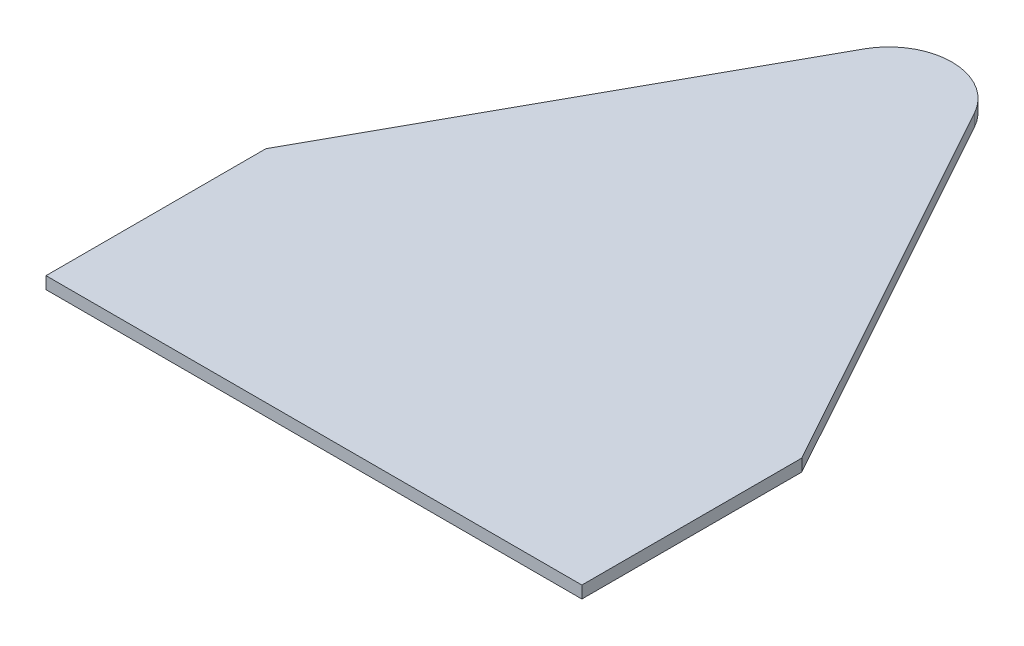
from build123d import *

# Parameters (mm, degrees)
BOSS_EXTRUDE1_DEPTH = 2.5


with BuildPart() as part:
    # Sketch1 → Boss-Extrude1 (new body)
    with BuildSketch(Plane(origin=(0, 0, 0), x_dir=(1, 0, 0), z_dir=(0, 1, 0))):
        with BuildLine():
            Line((-11.385, 124.53), (-55.125, 45.25))
            Line((-55.125, 45.25), (-55.125, 0))
            Line((-55.125, 0), (55.125, 0))
            Line((55.125, 0), (55.125, 45.25))
            Line((55.125, 45.25), (11.385, 124.53))
            ThreePointArc((11.385, 124.53), (0, 131.254509979), (-11.385, 124.53))
        make_face()
    extrude(amount=BOSS_EXTRUDE1_DEPTH)


solid = part.part
